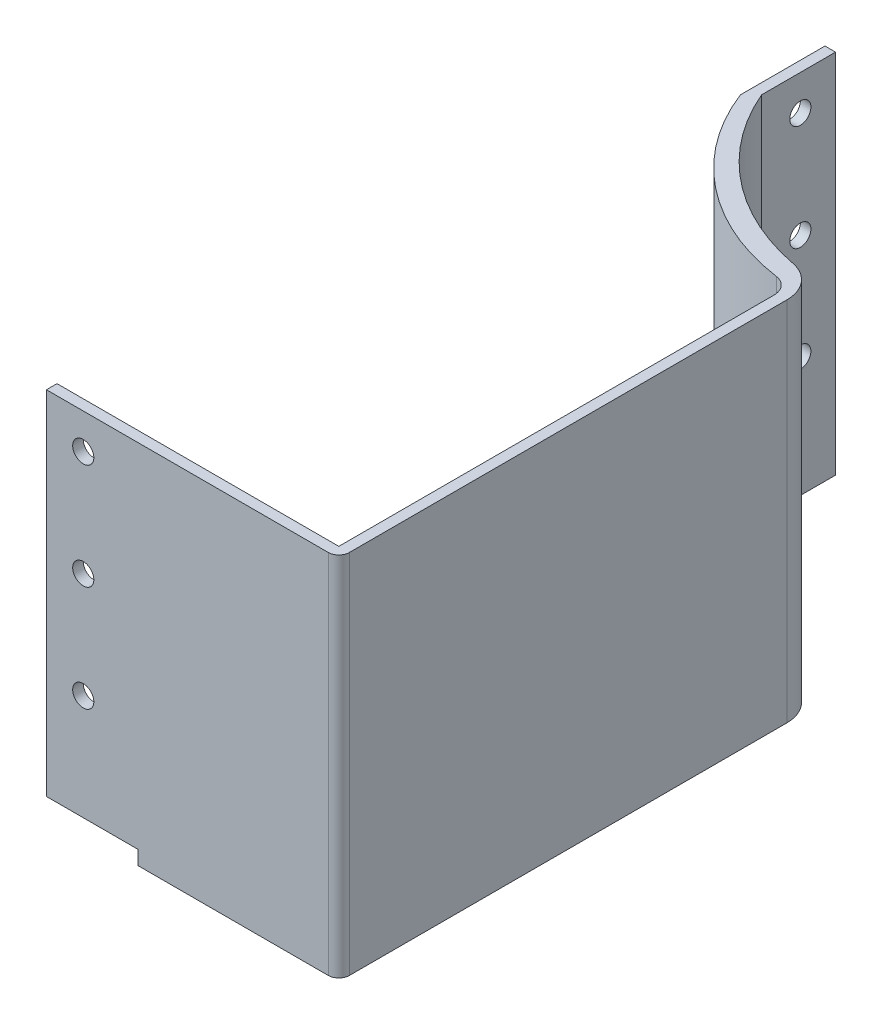
from build123d import *

# Parameters (mm, degrees)
EXTRUDE_1_DEPTH     = 100
FILLET_1_R          = 10
FILLET_2_R          = 3
SKETCH_2_R          = 3
CUT_EXTRUDE_1_DEPTH = 60
SKETCH_3_R          = 3
CUT_EXTRUDE_2_DEPTH = 60
FILLET_3_R          = 5
EXTRUDE_START       = 4
EXTRUDE_2_DEPTH     = 4


with BuildPart() as part:
    # Эскиз1 → Бобышка-Вытянуть1 (new body)
    with BuildSketch(Plane(origin=(0, 0, 0), x_dir=(1, 0, 0), z_dir=(0, 1, 0))):
        with BuildLine():
            Line((0, 152.272615506), (0, 176.272615506))
            Line((0, 176.272615506), (3, 176.272615506))
            Line((3, 176.272615506), (3, 155.272615506))
            ThreePointArc((3, 155.272615506), (24.600029492, 128.598973205), (57, 117.272615506))
            Line((57, 117.272615506), (57, -18.727384494))
            Line((57, -18.727384494), (-26, -18.727384494))
            Line((-26, -18.727384494), (-26, -15.727384494))
            Line((-26, -15.727384494), (54, -15.727384494))
            Line((54, -15.727384494), (54, 112.272615506))
            ThreePointArc((54, 112.272615506), (21.19671601, 124.438182118), (0, 152.272615506))
        make_face()
    extrude(amount=-EXTRUDE_1_DEPTH)

    # Скругление1
    fillet_1_edges = [part.edges().sort_by_distance(p)[0] for p in [
        (57, -50, -117.272615506),
    ]]
    fillet(fillet_1_edges, radius=FILLET_1_R)

    # Скругление2
    fillet_2_edges = [part.edges().sort_by_distance(p)[0] for p in [
        (57, -50, 18.727384494),
    ]]
    fillet(fillet_2_edges, radius=FILLET_2_R)

    # Эскиз2 → Вырез-Вытянуть1 (cut)
    with BuildSketch(Plane.XY.offset(18.727384494)):
        with Locations((-15.553601677, -10)):
            Circle(SKETCH_2_R)
        with Locations((-15.553601677, -40)):
            Circle(SKETCH_2_R)
        with Locations((-15.553601677, -70)):
            Circle(SKETCH_2_R)
    extrude(amount=-CUT_EXTRUDE_1_DEPTH, mode=Mode.SUBTRACT)

    # Эскиз3 → Вырез-Вытянуть2 (cut)
    with BuildSketch(Plane(origin=(3, 0, 0), x_dir=(0, 0, -1), z_dir=(1, 0, 0))):
        with Locations((166.272615506, -70)):
            Circle(SKETCH_3_R)
        with Locations((166.272615506, -40)):
            Circle(SKETCH_3_R)
        with Locations((166.272615506, -10)):
            Circle(SKETCH_3_R)
    extrude(amount=-CUT_EXTRUDE_2_DEPTH, mode=Mode.SUBTRACT)

    # Скругление3
    fillet_3_edges = [part.edges().sort_by_distance(p)[0] for p in [
        (54, -50, -112.272615506),
    ]]
    fillet(fillet_3_edges, radius=FILLET_3_R)

    # Эскиз4 → Бобышка-Вытянуть2 (add)
    with BuildSketch(Plane(origin=(0, -100, 0), x_dir=(-1, 0, 0), z_dir=(0, -1, 0)).offset(EXTRUDE_START)):
        with BuildLine():
            Line((-3, 155.272615506), (-3, 176.272615506))
            Line((-3, 176.272615506), (0, 176.272615506))
            Line((0, 176.272615506), (0, -18.727384494))
            Line((0, -18.727384494), (-54, -18.727384494))
            ThreePointArc((-54, -18.727384494), (-56.121320344, -17.848704838), (-57, -15.727384494))
            Line((-57, -15.727384494), (-57, 108.468113504))
            ThreePointArc((-57, 108.468113504), (-54.709126709, 114.837522062), (-48.886126924, 118.288629031))
            ThreePointArc((-48.886126924, 118.288629031), (-21.33303931, 131.060953474), (-3, 155.272615506))
        make_face()
    extrude(amount=-EXTRUDE_2_DEPTH)


solid = part.part
